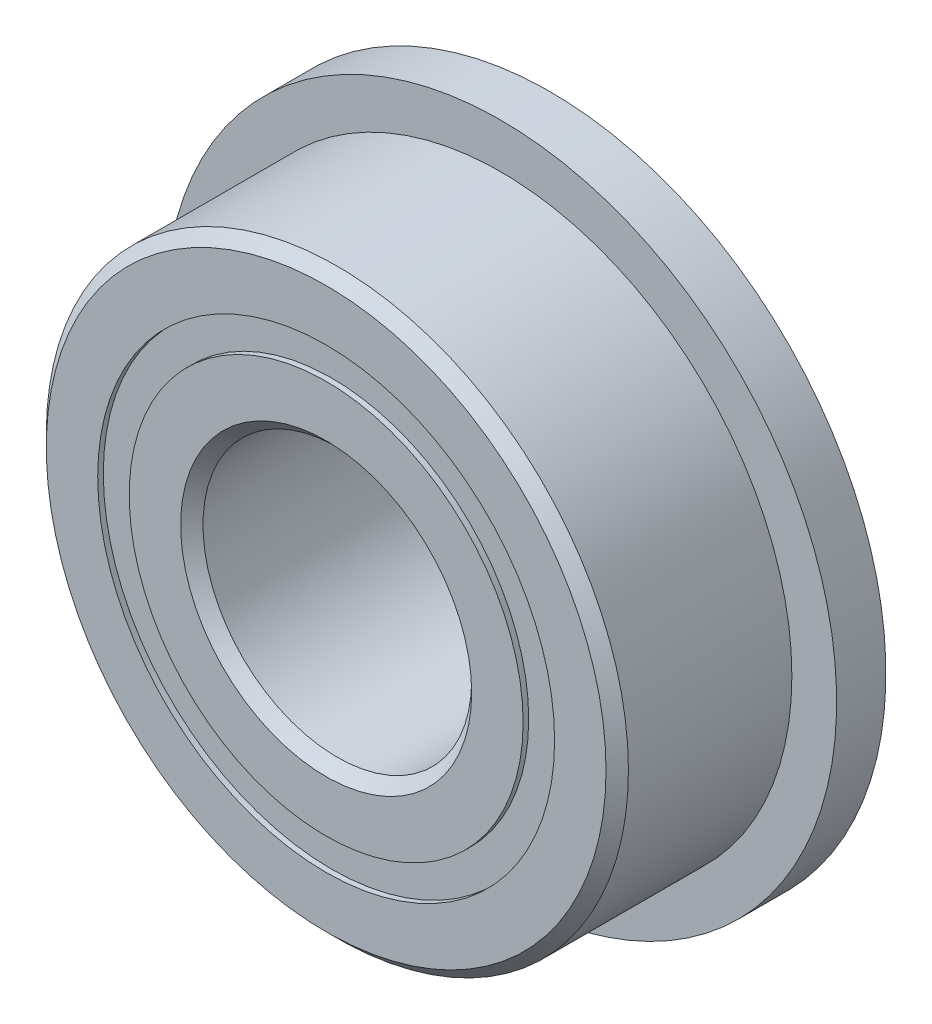
from build123d import *

# Parameters (mm, degrees)
CIRPATTERN1_COUNT = 12
SKETCH5_W         = 1.209571124
SKETCH5_H         = 0.703296704
SKETCH6_W         = 1.1
SKETCH6_H         = 2.398351648


with BuildPart() as part:
    # Sketch1 → Revolve1 (revolve)
    with BuildSketch(Plane(origin=(0, 0, 0), x_dir=(0, 0, -1), z_dir=(1, 0, 0))):
        with BuildLine():
            Line((2.25, 6.5), (-2.25, 6.5))
            Line((-2.25, 6.5), (-2.5, 6.25))
            Line((-2.5, 6.25), (-2.5, 5.101648352))
            Line((-2.5, 5.101648352), (-1.111111111, 5.101648352))
            ThreePointArc((-1.111111111, 5.101648352), (0, 5.915428876), (1.111111111, 5.101648352))
            Line((1.111111111, 5.101648352), (2.5, 5.101648352))
            Line((2.5, 5.101648352), (2.5, 6.25))
            Line((2.5, 6.25), (2.25, 6.5))
        make_face()
    revolve(axis=Axis((0, 0, 2.5), (0, 0, -1)))

    # Sketch6 → Revolve6 (revolve)
    with BuildSketch(Plane(origin=(0, 0, 0), x_dir=(0, 0, -1), z_dir=(1, 0, 0))):
        with Locations((1.95, 6.300824176)):
            Rectangle(SKETCH6_W, SKETCH6_H)
    revolve(axis=Axis((0, 0, -2.5), (0, 0, 1)))


with BuildPart() as body_2:
    # Sketch3 → Revolve3 (revolve)
    with BuildSketch(Plane(origin=(0, 0, 0), x_dir=(0, 0, -1), z_dir=(1, 0, 0))):
        with BuildLine():
            Line((-2.5, 4.398351648), (-1.111111111, 4.398351648))
            ThreePointArc((-1.111111111, 4.398351648), (0, 3.584571124), (1.111111111, 4.398351648))
            Line((1.111111111, 4.398351648), (2.5, 4.398351648))
            Line((2.5, 4.398351648), (2.5, 3.25))
            Line((2.5, 3.25), (2.25, 3))
            Line((2.25, 3), (-2.25, 3))
            Line((-2.25, 3), (-2.5, 3.25))
            Line((-2.5, 3.25), (-2.5, 4.398351648))
        make_face()
    revolve(axis=Axis((0, 0, 2.5), (0, 0, -1)))


with BuildPart() as body_3:
    # Sketch4 → Revolve4 (revolve)
    with BuildSketch(Plane(origin=(0, 0, 0), x_dir=(0, 0, -1), z_dir=(1, 0, 0))):
        with BuildLine():
            Line((-1.165428876, 4.75), (1.165428876, 4.75))
            ThreePointArc((1.165428876, 4.75), (0, 5.915428876), (-1.165428876, 4.75))
        make_face()
    revolve(axis=Axis((0, 4.75, 1.165428876), (0, 0, -1)))


with BuildPart() as cirpattern1_1:
    # CirPattern1: pattern copy
    add(body_3.part.rotate(Axis((0, 0, -2.5), (0, 0, 1)), 1 * 360 / CIRPATTERN1_COUNT))


with BuildPart() as cirpattern1_2:
    # CirPattern1: pattern copy
    add(body_3.part.rotate(Axis((0, 0, -2.5), (0, 0, 1)), 2 * 360 / CIRPATTERN1_COUNT))


with BuildPart() as cirpattern1_3:
    # CirPattern1: pattern copy
    add(body_3.part.rotate(Axis((0, 0, -2.5), (0, 0, 1)), 3 * 360 / CIRPATTERN1_COUNT))


with BuildPart() as cirpattern1_4:
    # CirPattern1: pattern copy
    add(body_3.part.rotate(Axis((0, 0, -2.5), (0, 0, 1)), 4 * 360 / CIRPATTERN1_COUNT))


with BuildPart() as cirpattern1_5:
    # CirPattern1: pattern copy
    add(body_3.part.rotate(Axis((0, 0, -2.5), (0, 0, 1)), 5 * 360 / CIRPATTERN1_COUNT))


with BuildPart() as cirpattern1_6:
    # CirPattern1: pattern copy
    add(body_3.part.rotate(Axis((0, 0, -2.5), (0, 0, 1)), 6 * 360 / CIRPATTERN1_COUNT))


with BuildPart() as cirpattern1_7:
    # CirPattern1: pattern copy
    add(body_3.part.rotate(Axis((0, 0, -2.5), (0, 0, 1)), 7 * 360 / CIRPATTERN1_COUNT))


with BuildPart() as cirpattern1_8:
    # CirPattern1: pattern copy
    add(body_3.part.rotate(Axis((0, 0, -2.5), (0, 0, 1)), 8 * 360 / CIRPATTERN1_COUNT))


with BuildPart() as cirpattern1_9:
    # CirPattern1: pattern copy
    add(body_3.part.rotate(Axis((0, 0, -2.5), (0, 0, 1)), 9 * 360 / CIRPATTERN1_COUNT))


with BuildPart() as cirpattern1_10:
    # CirPattern1: pattern copy
    add(body_3.part.rotate(Axis((0, 0, -2.5), (0, 0, 1)), 10 * 360 / CIRPATTERN1_COUNT))


with BuildPart() as cirpattern1_11:
    # CirPattern1: pattern copy
    add(body_3.part.rotate(Axis((0, 0, -2.5), (0, 0, 1)), 11 * 360 / CIRPATTERN1_COUNT))


with BuildPart() as body_15:
    # Sketch5 → Revolve5 (revolve)
    with BuildSketch(Plane(origin=(0, 0, 0), x_dir=(0, 0, -1), z_dir=(1, 0, 0))):
        with Locations((-1.770214438, 4.75)):
            Rectangle(SKETCH5_W, SKETCH5_H)
        with Locations((1.770214438, 4.75)):
            Rectangle(SKETCH5_W, SKETCH5_H)
    revolve(axis=Axis((0, 0, 2.5), (0, 0, -1)))


solid = Compound([part.part, body_2.part, body_3.part, cirpattern1_1.part, cirpattern1_2.part, cirpattern1_3.part, cirpattern1_4.part, cirpattern1_5.part, cirpattern1_6.part, cirpattern1_7.part, cirpattern1_8.part, cirpattern1_9.part, cirpattern1_10.part, cirpattern1_11.part, body_15.part])
